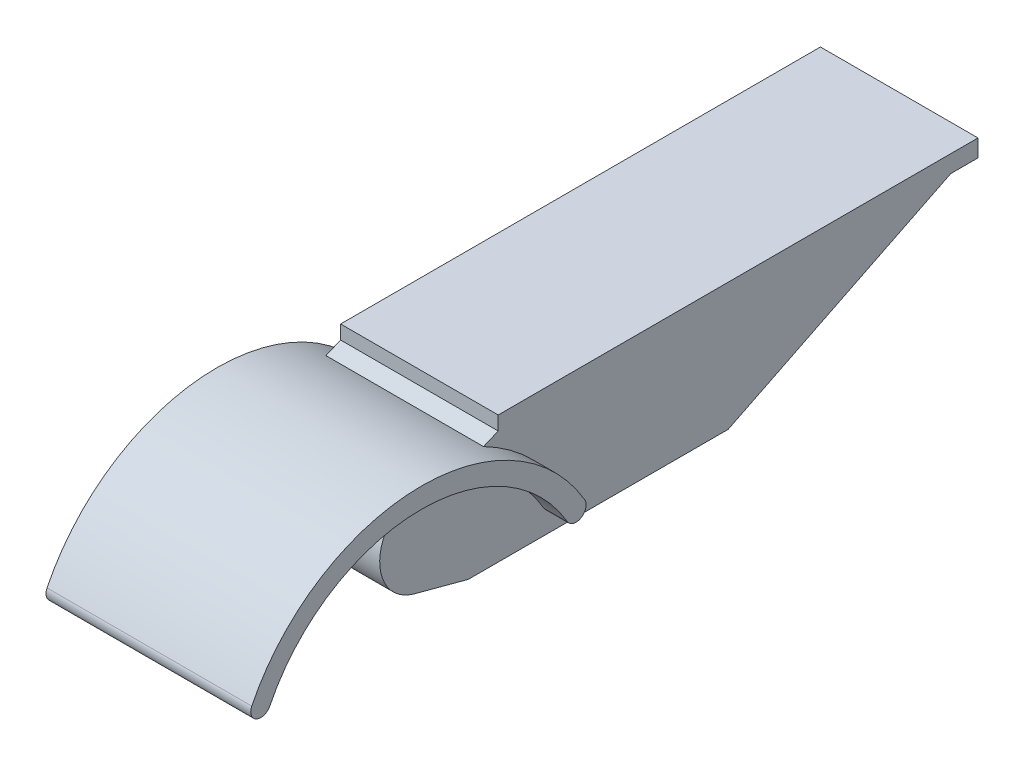
from build123d import *

# Parameters (mm, degrees)
BOSS_EXTRUDE1_DEPTH = 7.9375
BOSS_EXTRUDE2_DEPTH = 10.3124


with BuildPart() as part:
    # Sketch3 → Boss-Extrude1 (new, symmetric)
    with BuildSketch(Plane(origin=(0, 0, 0), x_dir=(0, 0, -1), z_dir=(1, 0, 0))):
        with BuildLine():
            Line((40.513, 14.235338715), (40.513, 12.495229879))
            Line((40.513, 12.495229879), (37.766212018, 12.495229879))
            Line((37.766212018, 12.495229879), (15.349467418, 1.395404479))
            Line((15.349467418, 1.395404479), (-10.837881782, 1.395404479))
            Line((-10.837881782, 1.395404479), (-16.27838917, 2.853173638))
            ThreePointArc((-16.27838917, 2.853173638), (-19.721025133, 8.005427537), (-15.0622, 12.0911112))
            Line((-15.0622, 12.0911112), (-9.601272901, 12.0911112))
            Line((-9.601272901, 12.0911112), (-7.8233016, 12.835531808))
            Line((-7.8233016, 12.835531808), (-7.8233016, 14.235338715))
            Line((-7.8233016, 14.235338715), (40.513, 14.235338715))
        make_face()
    extrude(amount=BOSS_EXTRUDE1_DEPTH, both=True)

    # Sketch4 → Boss-Extrude2 (add, symmetric)
    with BuildSketch(Plane(origin=(0, 0, 0), x_dir=(0, 0, -1), z_dir=(1, 0, 0))):
        with BuildLine():
            ThreePointArc((-3.239093433, 3.82959498), (-1.848605226, 3.466296321), (-1.485306567, 4.856784528))
            ThreePointArc((-1.485306567, 4.856784528), (-18.623790881, 14.266172543), (-35.024465128, 3.622765587))
            ThreePointArc((-35.024465128, 3.622765587), (-34.559965587, 2.262734872), (-33.199934872, 2.727234413))
            ThreePointArc((-33.199934872, 2.727234413), (-18.549060441, 12.235088571), (-3.239093433, 3.82959498))
        make_face()
    extrude(amount=BOSS_EXTRUDE2_DEPTH, both=True)


solid = part.part
